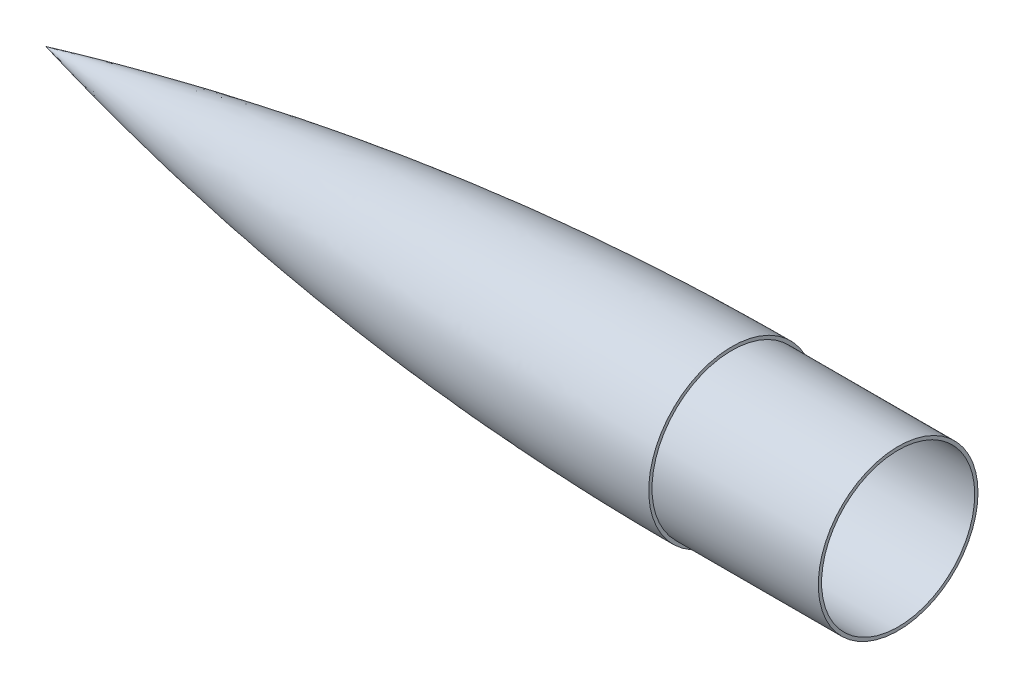
from build123d import *

# Parameters (mm, degrees)
SKETCH3_R           = 48.7934
SKETCH3_R_2         = 46.7868
BOSS_EXTRUDE1_DEPTH = 101.6


with BuildPart() as part:
    # Sketch2 → Revolve1 (revolve)
    with BuildSketch(Plane.XY):
        with BuildLine():
            Line((0, 48.7934), (0, 50.8))
            ThreePointArc((0, 50.8), (-211.08378076, 38.053691271), (-419.1, 0))
            Line((-419.1, 0), (-410.620178716, 0))
            ThreePointArc((-410.620178716, 0), (-206.754520538, 36.552290499), (0, 48.7934))
        make_face()
    revolve(axis=Axis((-410.620178716, 0, 0), (-1, 0, 0)))


with BuildPart() as body_2:
    # Sketch3 → Boss-Extrude1 (new body)
    with BuildSketch(Plane(origin=(0, 0, 0), x_dir=(0, 0, -1), z_dir=(1, 0, 0))):
        Circle(SKETCH3_R)
        Circle(SKETCH3_R_2, mode=Mode.SUBTRACT)
    extrude(amount=BOSS_EXTRUDE1_DEPTH)


solid = Compound([part.part, body_2.part])
